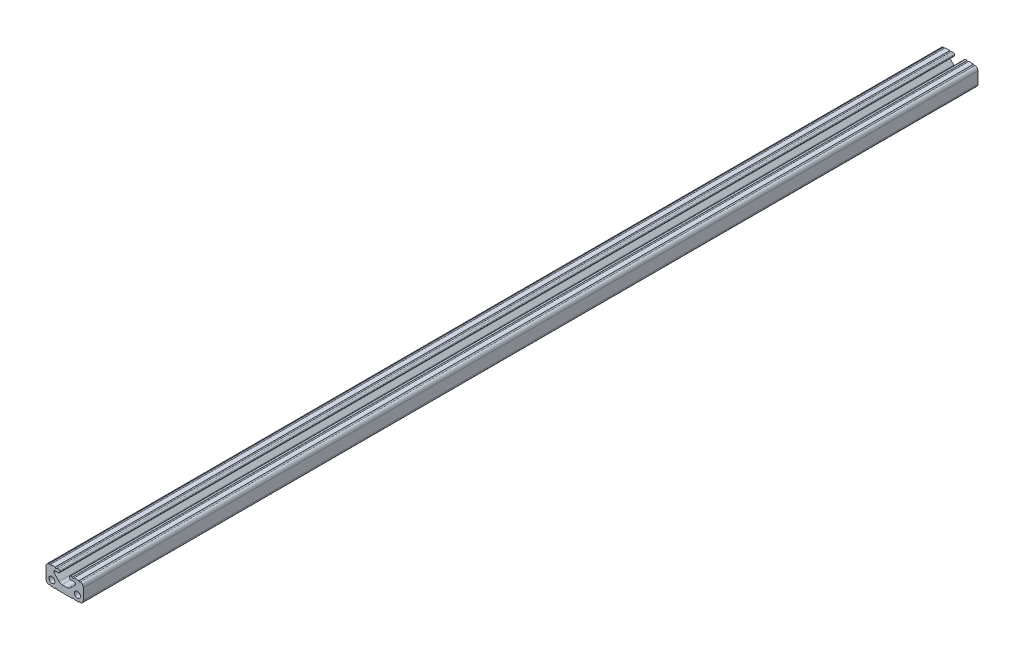
from build123d import *

# Parameters (mm, degrees)
SKETCH3_R               = 2.032
BOSS_EXTRUDE1_DEPTH     = 304.8
CUT_EXTRUDE1_DEPTH      = 306.130549929
CUT_EXTRUDE1_DEPTH_BACK = 306.130549929
SKETCH4_R               = 0.55245


with BuildPart() as part:
    # Sketch3 → Boss-Extrude1 (new, symmetric)
    with BuildSketch(Plane.XY):
        with BuildLine():
            Line((3.2512, 5.35559), (3.2512, 5.13461))
            ThreePointArc((3.2512, 5.13461), (3.542455946, 4.431455946), (4.24561, 4.1402))
            Line((4.24561, 4.1402), (6.42239, 4.1402))
            ThreePointArc((6.42239, 4.1402), (7.341105046, 3.526334232), (7.125544054, 2.442635946))
            Line((7.125544054, 2.442635946), (3.854875946, -0.828032163))
            ThreePointArc((3.854875946, -0.828032163), (2.887046479, -1.474715138), (1.745413783, -1.7018))
            Line((1.745413783, -1.7018), (0, -1.7018))
            Line((0, -1.7018), (0, -6.35))
            Line((0, -6.35), (10.16, -6.35))
            ThreePointArc((10.16, -6.35), (11.956051224, -5.606051224), (12.7, -3.81))
            Line((12.7, -3.81), (12.7, 3.81))
            ThreePointArc((12.7, 3.81), (11.956051224, 5.606051224), (10.16, 6.35))
            Line((10.16, 6.35), (4.24561, 6.35))
            ThreePointArc((4.24561, 6.35), (3.542455946, 6.058744054), (3.2512, 5.35559))
        make_face()
        with Locations(Location((8.7249, -2.3876, 0), (0, 0, 180))):
            Circle(SKETCH3_R, mode=Mode.SUBTRACT)
    extrude(amount=BOSS_EXTRUDE1_DEPTH, both=True)

    # Sketch4 → Cut-Extrude1 (cut, two sides: drawn at the far end of the back side and taken through both)
    with BuildSketch(Plane.XY.offset(-CUT_EXTRUDE1_DEPTH_BACK)):
        with Locations((5.86994, 6.35)):
            Circle(SKETCH4_R)
        with Locations((10.20445, 6.35)):
            Circle(SKETCH4_R)
        with Locations((5.86994, -6.35)):
            Circle(SKETCH4_R)
        with Locations((10.20445, -6.35)):
            Circle(SKETCH4_R)
    extrude(amount=CUT_EXTRUDE1_DEPTH + CUT_EXTRUDE1_DEPTH_BACK, mode=Mode.SUBTRACT)

    # Mirror1: part across plane


with BuildPart() as part_1:
    add(part.part)
    add(part.part.mirror(Plane(origin=(0, 0, 0), x_dir=(0, 0, 1), z_dir=(1, 0, 0))))


solid = part_1.part
